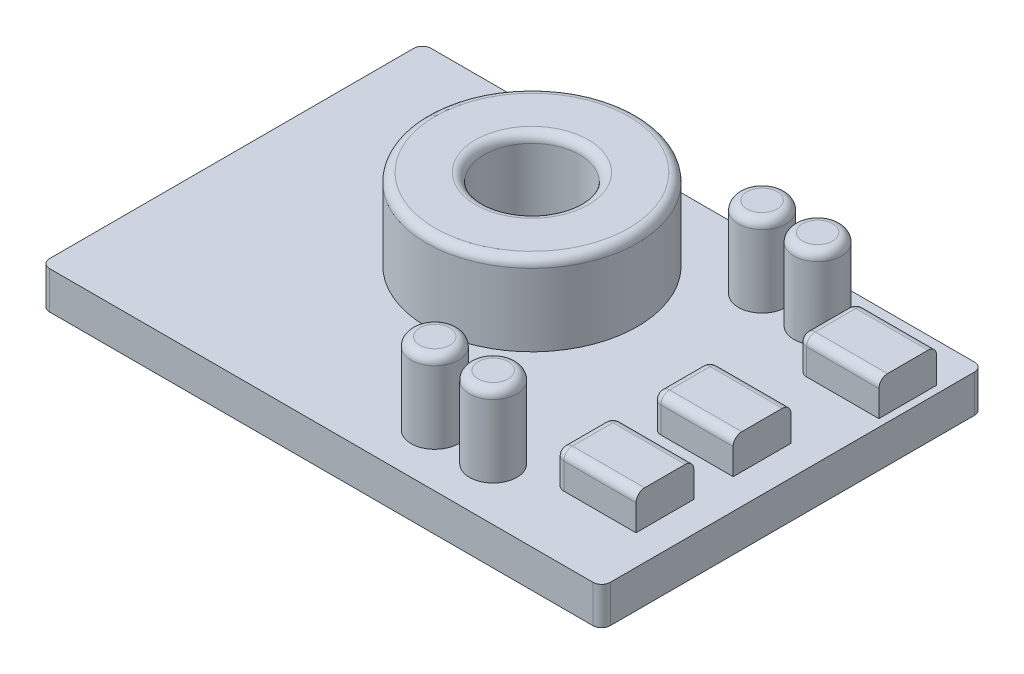
from build123d import *

# Parameters (mm, degrees)
SKETCH1_W      = 97
SKETCH1_H      = 66
EXTRUDE1_DEPTH = 6.5
SKETCH2_R      = 18.25
SKETCH2_R_2    = 8.25
SKETCH2_R_3    = 4.1
EXTRUDE2_DEPTH = 14
SKETCH3_W      = 14
SKETCH3_H      = 10
EXTRUDE3_DEPTH = 6
FILLET1_R      = 1.5
FILLET2_R      = 1.5
FILLET3_R      = 1.5


with BuildPart() as part:
    # Sketch1 → Extrude1 (new body)
    with BuildSketch(Plane(origin=(0, 0, 0), x_dir=(1, 0, 0), z_dir=(0, 1, 0))):
        Rectangle(SKETCH1_W, SKETCH1_H)
    extrude(amount=EXTRUDE1_DEPTH)

    # Sketch2 → Extrude2 (add)
    # profile 1 of 5: a face of its own
    with BuildSketch(Plane(origin=(0, 6.5, 0), x_dir=(1, 0, 0), z_dir=(0, 1, 0))):
        with Locations(Location((-5.702169219, 9.153482167, 0), (0, 0, 270))):
            Circle(SKETCH2_R)
        with Locations(Location((-5.702169219, 9.153482167, 0), (0, 0, 270))):
            Circle(SKETCH2_R_2, mode=Mode.SUBTRACT)
    # profile 2 of 5: a face of its own
    with BuildSketch(Plane(origin=(0, 6.5, 0), x_dir=(1, 0, 0), z_dir=(0, 1, 0))):
        with Locations(Location((18.407002391, 24.859457033, 0), (0, 0, 90))):
            Circle(SKETCH2_R_3)
    # profile 3 of 5: a face of its own
    with BuildSketch(Plane(origin=(0, 6.5, 0), x_dir=(1, 0, 0), z_dir=(0, 1, 0))):
        with Locations(Location((28.010655812, 24.859457033, 0), (0, 0, 90))):
            Circle(SKETCH2_R_3)
    # profile 4 of 5: a face of its own
    with BuildSketch(Plane(origin=(0, 6.5, 0), x_dir=(1, 0, 0), z_dir=(0, 1, 0))):
        with Locations(Location((10.50399593, -23.859076469, 0), (0, 0, 90))):
            Circle(SKETCH2_R_3)
    # profile 5 of 5: a face of its own
    with BuildSketch(Plane(origin=(0, 6.5, 0), x_dir=(1, 0, 0), z_dir=(0, 1, 0))):
        with Locations(Location((20.607839633, -23.859076469, 0), (0, 0, 90))):
            Circle(SKETCH2_R_3)
    extrude(amount=EXTRUDE2_DEPTH)

    # Sketch3 → Extrude3 (add)
    with BuildSketch(Plane(origin=(0, 6.5, 0), x_dir=(1, 0, 0), z_dir=(0, 1, 0))):
        with Locations((40.212634749, 21.256184177)):
            Rectangle(SKETCH3_W, SKETCH3_H)
        with Locations((36.311150546, -0.051921852)):
            Rectangle(SKETCH3_W, SKETCH3_H)
        with Locations((36.311150546, -16.858315339)):
            Rectangle(SKETCH3_W, SKETCH3_H)
    extrude(amount=EXTRUDE3_DEPTH)

    # Fillet1
    fillet1_edges = [part.edges().sort_by_distance(p)[0] for p in [
        (48.5, 3.25, 33),
        (-48.5, 3.25, 33),
        (-48.5, 3.25, -33),
        (48.5, 3.25, -33),
    ]]
    fillet(fillet1_edges, radius=FILLET1_R)

    # Fillet2
    fillet2_edges = [part.edges().sort_by_distance(p)[0] for p in [
        (-5.702169219, 20.5, -27.403482167),
        (-5.702169219, 20.5, -17.403482167),
        (18.407002391, 20.5, -20.759457033),
        (28.010655812, 20.5, -20.759457033),
        (10.50399593, 20.5, 27.959076469),
        (20.607839633, 20.5, 27.959076469),
        (40.212634749, 12.5, -16.256184177),
        (40.212634749, 12.5, -26.256184177),
        (36.311150546, 12.5, 5.051921852),
        (36.311150546, 12.5, -4.948078148),
        (36.311150546, 12.5, 21.858315339),
        (36.311150546, 12.5, 11.858315339),
    ]]
    fillet(fillet2_edges, radius=FILLET2_R)

    # Fillet3
    fillet3_edges = [part.edges().sort_by_distance(p)[0] for p in [
        (29.311150546, 8.75, 21.858315339),
        (29.311150546, 8.75, 11.858315339),
        (29.311150546, 12.060660172, 12.297655167),
        (29.311150546, 12.060660172, 21.418975511),
        (29.311150546, 12.5, 0.051921852),
        (29.311150546, 8.75, 5.051921852),
        (29.311150546, 8.75, -4.948078148),
        (29.311150546, 12.060660172, -4.50873832),
        (29.311150546, 12.060660172, 4.612582024),
        (33.212634749, 12.5, -21.256184177),
        (33.212634749, 8.75, -16.256184177),
        (33.212634749, 8.75, -26.256184177),
        (33.212634749, 12.060660172, -16.695524005),
        (33.212634749, 12.060660172, -25.816844349),
        (29.311150546, 12.5, 16.858315339),
    ]]
    fillet(fillet3_edges, radius=FILLET3_R)


solid = part.part
